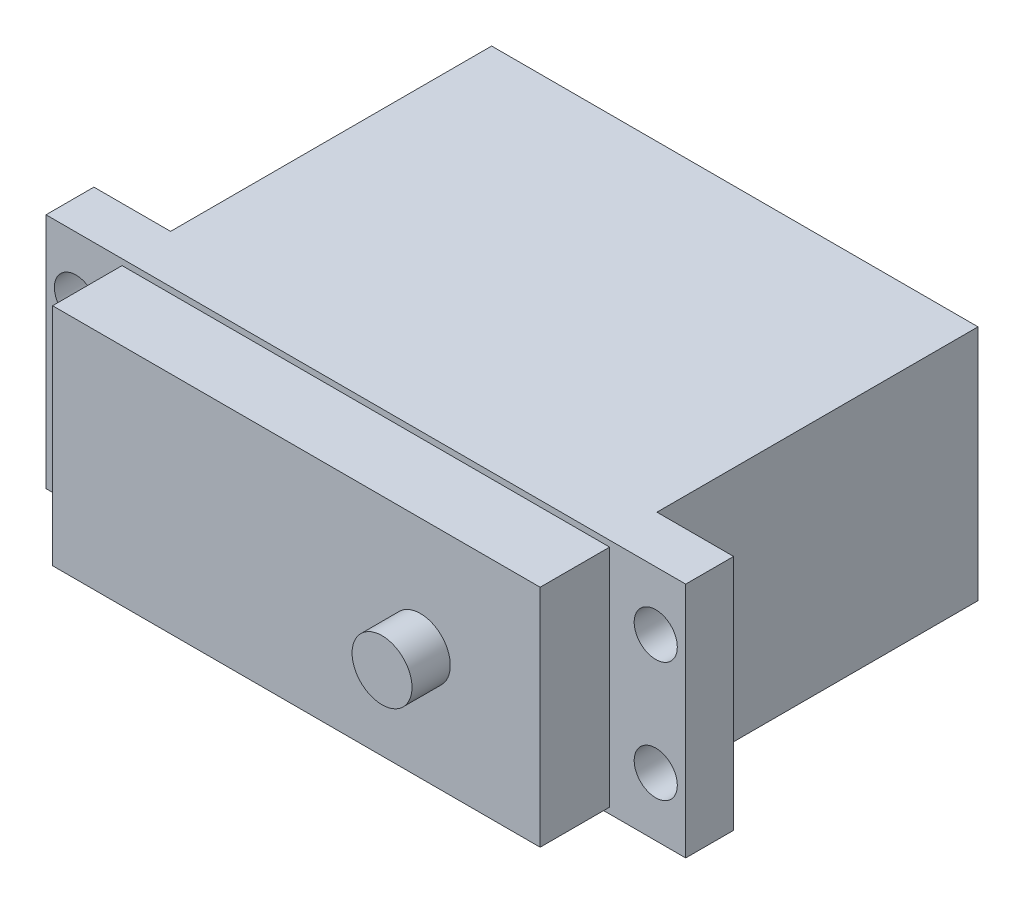
from build123d import *

# Parameters (mm, degrees)
SKETCH1_W            = 40.6
SKETCH1_H            = 19.8
BOSS_EXTRUDE1_DEPTH  = 26.8
SKETCH2_W            = 53.4
SKETCH2_H            = 19.8
BOSS_EXTRUDE2_DEPTH  = 4
M3_CLEARANCE_HOLE1_D = 3.6
SKETCH6_W            = 40.7
SKETCH6_H            = 18.8
BOSS_EXTRUDE3_DEPTH  = 5.8
SKETCH7_R            = 2.5
BOSS_EXTRUDE4_DEPTH  = 3.2


with BuildPart() as part:
    # Sketch1 → Boss-Extrude1 (new body)
    with BuildSketch(Plane.XY):
        with Locations((20.3, 9.9)):
            Rectangle(SKETCH1_W, SKETCH1_H)
    extrude(amount=BOSS_EXTRUDE1_DEPTH)

    # Sketch2 → Boss-Extrude2 (add)
    with BuildSketch(Plane.XY.offset(26.8)):
        with Locations((20.3, 9.9)):
            Rectangle(SKETCH2_W, SKETCH2_H)
    extrude(amount=BOSS_EXTRUDE2_DEPTH)

    # M3 Clearance Hole1 (through all)
    with Locations(Plane.XY.offset(30.8)):
        with Locations((-3.9, 14.9), (-3.9, 4.9), (44.5, 4.9), (44.5, 14.9)):
            Hole(M3_CLEARANCE_HOLE1_D / 2)

    # Sketch6 → Boss-Extrude3 (add)
    with BuildSketch(Plane.XY.offset(30.8)):
        with Locations((20.3, 9.9)):
            Rectangle(SKETCH6_W, SKETCH6_H)
    extrude(amount=BOSS_EXTRUDE3_DEPTH)

    # Sketch7 → Boss-Extrude4 (add)
    with BuildSketch(Plane.XY.offset(36.6)):
        with Locations(Location((30.65, 9.9, 0), (0, 0, 180))):
            Circle(SKETCH7_R)
    extrude(amount=BOSS_EXTRUDE4_DEPTH)


solid = part.part
